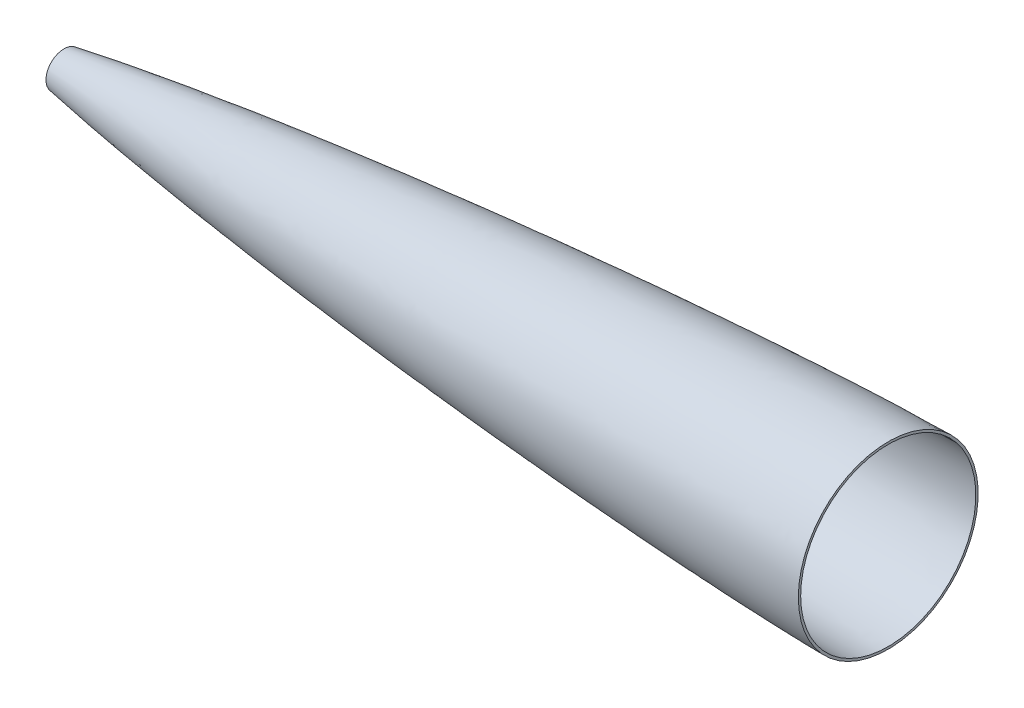
from build123d import *


with BuildPart() as part:
    # Sketch1 → Revolve1 (revolve)
    with BuildSketch(Plane.XY, mode=Mode.PRIVATE) as revolve1_sk:
        with BuildLine():
            Line((63.844148043, 29.640928436), (63.499999998, 29.640928436))
            Line((63.499999998, 29.640928436), (63.499999998, 31.59200905))
            add(Edge.make_bspline(
                [(63.499999998, 31.59200905), (64.546964267, 31.776681433), (66.592471666, 32.134751742), (70.698527018, 32.847044799), (74.750398099, 33.531199528), (80.78596569, 34.540615012), (87.475265265, 35.62883694), (96.325729606, 37.03669292), (106.861463366, 38.656253166), (118.224703043, 40.350591594), (130.243974382, 42.084277632), (142.308182136, 43.774413487), (154.356468913, 45.414656781), (166.423528567, 47.014754136), (178.488403104, 48.574050881), (193.57994506, 50.477704647), (211.696044954, 52.69191156), (232.844260117, 55.181698871), (257.026256814, 57.909540856), (281.220777935, 60.528538672), (305.425855289, 63.045195415), (329.6409986, 65.464781895), (353.865153299, 67.791266257), (378.097843922, 70.027741332), (402.338438175, 72.176413941), (432.648570943, 74.75440698), (462.970550935, 77.189937909), (493.303614435, 79.483491275), (523.647200354, 81.632095246), (547.928205589, 83.262105287), (578.286947122, 85.184871927), (614.729190146, 87.300943648), (651.185819497, 89.157882644), (687.656741902, 90.708498065), (715.948913969, 91.672832213), (734.069381353, 92.163698815), (748.096093738, 92.445567822), (756.040961089, 92.551476456), (760.013616272, 92.585277632), (761.999999997, 92.589681199)],
                knots=[0.084397822, 0.084397822, 0.084397822, 0.084397822, 0.084397822, 0.090458427, 0.096519032, 0.102579638, 0.108640243, 0.120761454, 0.132882664, 0.148760449, 0.164638233, 0.180516018, 0.196393803, 0.212271586, 0.228149369, 0.244027153, 0.259904936, 0.291660504, 0.323416071, 0.35517164, 0.386927208, 0.418682776, 0.450438343, 0.482193911, 0.513949479, 0.545705047, 0.577460615, 0.64097175, 0.672727318, 0.704482886, 0.736238454, 0.767994022, 0.831505157, 0.895016293, 0.926771861, 0.958527428, 0.979263714, 0.989631857, 1, 1, 1, 1, 1], degree=4))
            Line((761.999999997, 92.589681199), (761.999999997, 90.608476308))
            add(Edge.make_bspline(
                [(63.844148043, 29.640928436), (64.256972952, 29.713745973), (65.070829398, 29.856825785), (66.793855506, 30.157940763), (69.224120297, 30.579698752), (72.051562632, 31.06493732), (74.591242962, 31.49443938), (77.263835523, 31.942585716), (80.049497238, 32.406089152), (82.770106829, 32.853704565), (86.340004566, 33.43467787), (90.818481793, 34.153438179), (98.078194353, 35.299570842), (110.666908432, 37.234319236), (128.759255507, 39.889467738), (172.156848882, 45.917654797), (237.431156738, 53.936460388), (324.621308067, 63.164051715), (411.938915566, 71.182709907), (499.350643562, 78.094317145), (572.260680839, 82.922284602), (630.623773587, 86.149534436), (674.411620852, 88.207816642), (710.915033583, 89.558592856), (736.466558623, 90.237471718), (751.068941605, 90.508208652), (758.363139623, 90.60037135), (761.999633991, 90.608475493), (761.999999997, 90.608476308)],
                knots=[0.084397822, 0.084397822, 0.084397822, 0.084397822, 0.086186107, 0.087974393, 0.091550964, 0.095127535, 0.098704106, 0.102280677, 0.105857248, 0.109433819, 0.11301039, 0.120163532, 0.127316674, 0.141622958, 0.170235526, 0.198848094, 0.313298366, 0.427748639, 0.542198911, 0.656649183, 0.771099455, 0.828324592, 0.885549728, 0.942774864, 0.971387432, 0.985693716, 0.999992802, 0.999994242, 0.999994242, 0.999994242, 0.999994242], degree=3))
        make_face()
    revolve(revolve1_sk.sketch.rotate(Axis((-9.7e-08, 16.389681199, 0), (1, 0, 0)), 90), axis=Axis((-9.7e-08, 16.389681199, 0), (1, 0, 0)))


solid = part.part
